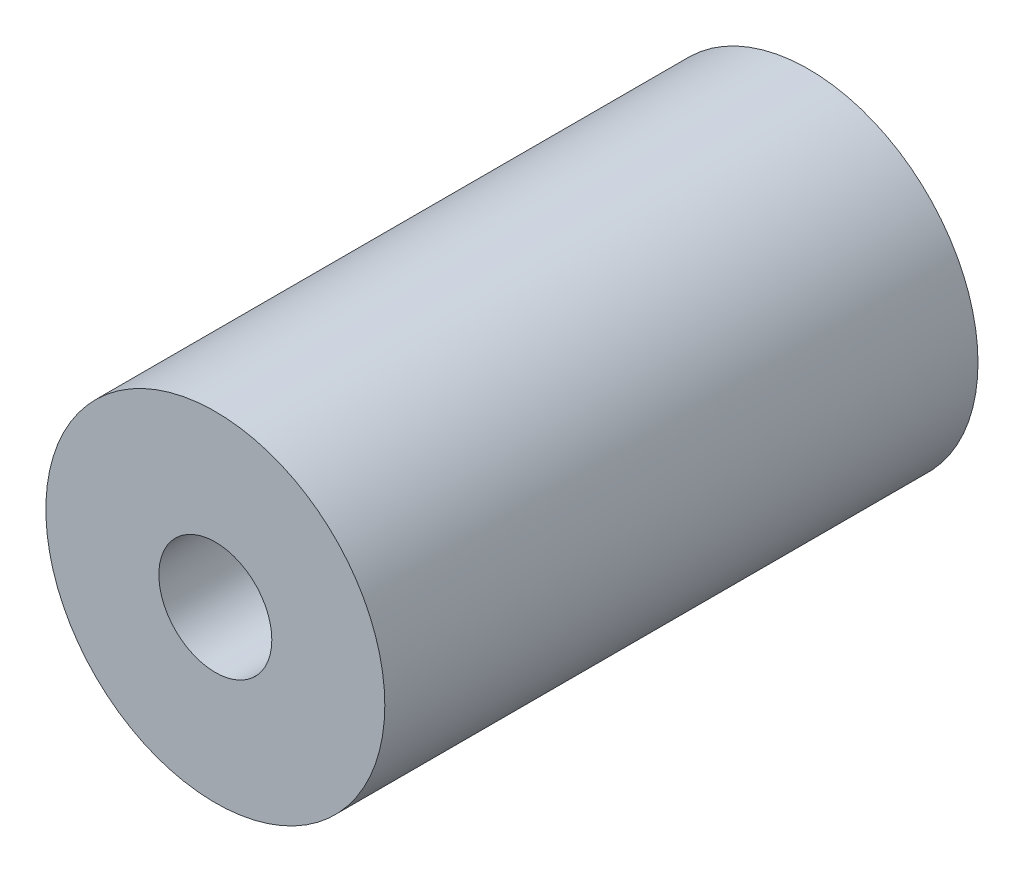
from build123d import *

# Parameters (mm, degrees)
SKETCH1_R           = 30
SKETCH1_R_2         = 10
BOSS_EXTRUDE1_DEPTH = 105


with BuildPart() as part:
    # Sketch1 → Boss-Extrude1 (new body)
    with BuildSketch(Plane.XY):
        Circle(SKETCH1_R)
        Circle(SKETCH1_R_2, mode=Mode.SUBTRACT)
    extrude(amount=BOSS_EXTRUDE1_DEPTH)


solid = part.part
